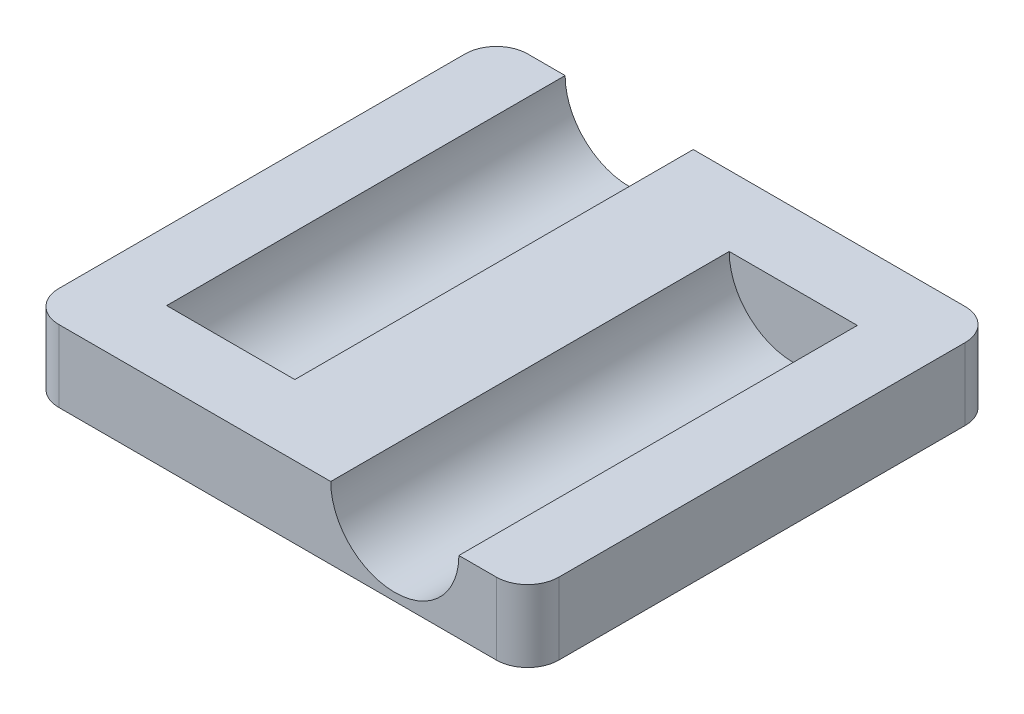
from build123d import *

# Parameters (mm, degrees)
SKETCH1_W           = 32
SKETCH1_H           = 6.5
BOSS_EXTRUDE1_DEPTH = 30
FILLET1_R           = 2
SKETCH2_R           = 4.1
CUT_EXTRUDE1_DEPTH  = 25.5
SKETCH3_R           = 4.1
CUT_EXTRUDE2_DEPTH  = 25.5
SKETCH5_W           = 32
SKETCH5_H           = 0.1
CUT_EXTRUDE3_DEPTH  = 37.629308734
SKETCH6_W           = 32
SKETCH6_H           = 1.8
CUT_EXTRUDE4_DEPTH  = 37.629308734


with BuildPart() as part:
    # Sketch1 → Boss-Extrude1 (new body)
    with BuildSketch(Plane.XY):
        with Locations((3.954315745, -3.347843701)):
            Rectangle(SKETCH1_W, SKETCH1_H)
    extrude(amount=BOSS_EXTRUDE1_DEPTH)

    # Fillet1
    fillet1_edges = [part.edges().sort_by_distance(p)[0] for p in [
        (19.954315745, -3.347843701, 30),
        (-12.045684255, -3.347843701, 30),
        (19.954315745, -3.347843701, 0),
        (-12.045684255, -3.347843701, 0),
    ]]
    fillet(fillet1_edges, radius=FILLET1_R)

    # Sketch2 → Cut-Extrude1 (cut)
    with BuildSketch(Plane(origin=(0, 0, 0), x_dir=(-1, 0, 0), z_dir=(0, 0, -1))):
        with Locations((3.545684255, -0.197843701)):
            Circle(SKETCH2_R)
    extrude(amount=-CUT_EXTRUDE1_DEPTH, mode=Mode.SUBTRACT)

    # Sketch3 → Cut-Extrude2 (cut)
    with BuildSketch(Plane.XY.offset(30)):
        with Locations((11.454315745, -0.197843701)):
            Circle(SKETCH3_R)
    extrude(amount=-CUT_EXTRUDE2_DEPTH, mode=Mode.SUBTRACT)

    # Sketch5 → Cut-Extrude3 (cut, through all)
    with BuildSketch(Plane.XY.offset(30)):
        with Locations((3.954315745, -0.147843701)):
            Rectangle(SKETCH5_W, SKETCH5_H)
    extrude(amount=-CUT_EXTRUDE3_DEPTH, mode=Mode.SUBTRACT)

    # Sketch6 → Cut-Extrude4 (cut, through all)
    with BuildSketch(Plane.XY.offset(30)):
        with Locations((3.954315745, -5.697843701)):
            Rectangle(SKETCH6_W, SKETCH6_H)
    extrude(amount=-CUT_EXTRUDE4_DEPTH, mode=Mode.SUBTRACT)


solid = part.part
